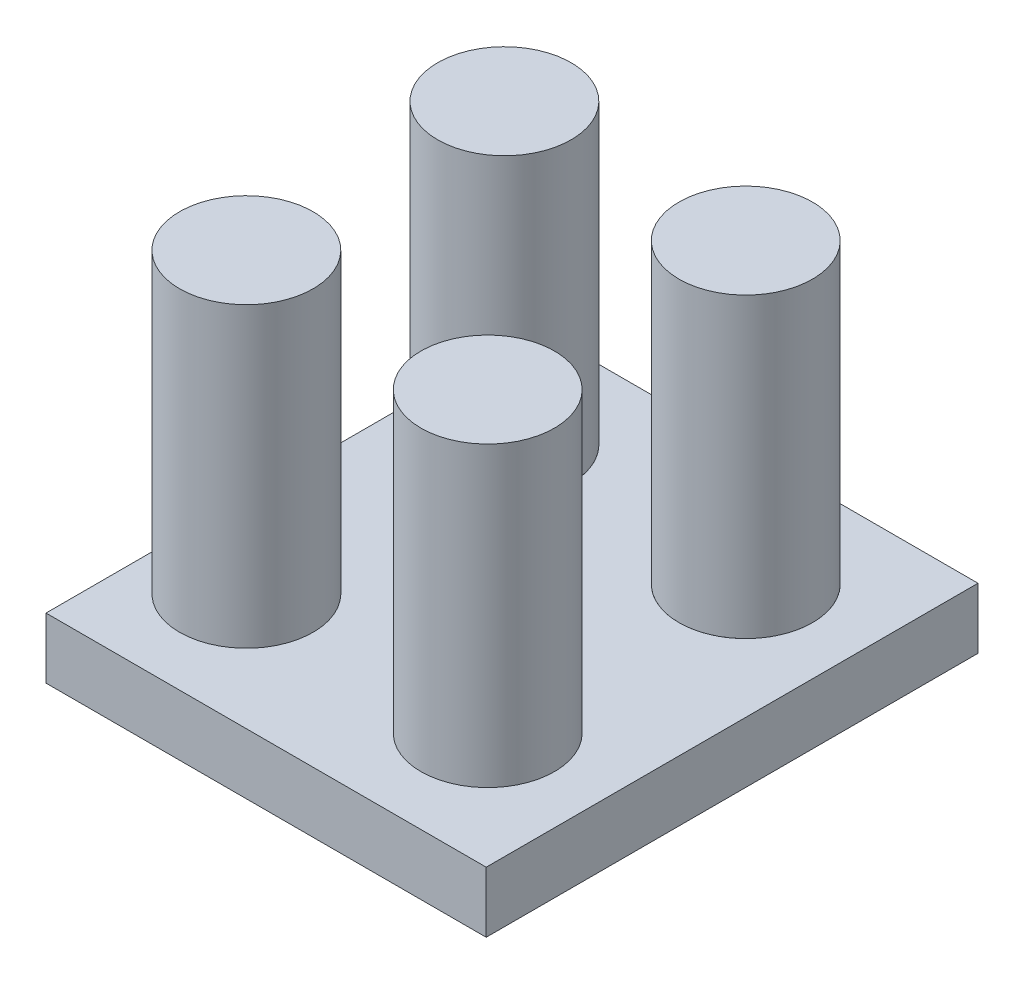
from build123d import *

# Parameters (mm, degrees)
SKETCH1_W             = 14.5
SKETCH1_H             = 16.2
SKETCH1_R             = 2.2
BOSS_EXTRUDE2_DEPTH   = 2
SKETCH2_R             = 2.2
BOSS_EXTRUDE3_DEPTH   = 9.8
BOSS_EXTRUDE3_2_DEPTH = 9.8
BOSS_EXTRUDE3_3_DEPTH = 9.8
BOSS_EXTRUDE3_4_DEPTH = 9.8


with BuildPart() as part:
    # Sketch1 → Boss-Extrude2 (new body)
    with BuildSketch(Plane(origin=(0, 0, 0), x_dir=(1, 0, 0), z_dir=(0, 1, 0))):
        Rectangle(SKETCH1_W, SKETCH1_H)
        with Locations(Location((3.45, -4.25, 0), (0, 0, 270))):
            Circle(SKETCH1_R, mode=Mode.SUBTRACT)
        with Locations(Location((-4.5, -4.25, 0), (0, 0, 270))):
            Circle(SKETCH1_R, mode=Mode.SUBTRACT)
        with Locations(Location((-4.5, 4.25, 0), (0, 0, 90))):
            Circle(SKETCH1_R, mode=Mode.SUBTRACT)
        with Locations(Location((3.45, 4.25, 0), (0, 0, 90))):
            Circle(SKETCH1_R, mode=Mode.SUBTRACT)
    extrude(amount=BOSS_EXTRUDE2_DEPTH)


with BuildPart() as body_2:
    # Sketch2 → Boss-Extrude3 (new body)
    with BuildSketch(Plane(origin=(0, 2, 0), x_dir=(1, 0, 0), z_dir=(0, 1, 0))):
        with Locations(Location((3.45, 4.25, 0), (0, 0, 270))):
            Circle(SKETCH2_R)
    extrude(amount=BOSS_EXTRUDE3_DEPTH)


with BuildPart() as body_3:
    # Sketch2 → Boss-Extrude3 2 (new body)
    with BuildSketch(Plane(origin=(0, 2, 0), x_dir=(1, 0, 0), z_dir=(0, 1, 0))):
        with Locations(Location((-4.5, 4.25, 0), (0, 0, 270))):
            Circle(SKETCH2_R)
    extrude(amount=BOSS_EXTRUDE3_2_DEPTH)


with BuildPart() as body_4:
    # Sketch2 → Boss-Extrude3 3 (new body)
    with BuildSketch(Plane(origin=(0, 2, 0), x_dir=(1, 0, 0), z_dir=(0, 1, 0))):
        with Locations(Location((3.45, -4.25, 0), (0, 0, 270))):
            Circle(SKETCH2_R)
    extrude(amount=BOSS_EXTRUDE3_3_DEPTH)


with BuildPart() as body_5:
    # Sketch2 → Boss-Extrude3 4 (new body)
    with BuildSketch(Plane(origin=(0, 2, 0), x_dir=(1, 0, 0), z_dir=(0, 1, 0))):
        with Locations(Location((-4.5, -4.25, 0), (0, 0, 270))):
            Circle(SKETCH2_R)
    extrude(amount=BOSS_EXTRUDE3_4_DEPTH)


solid = Compound([part.part, body_2.part, body_3.part, body_4.part, body_5.part])
